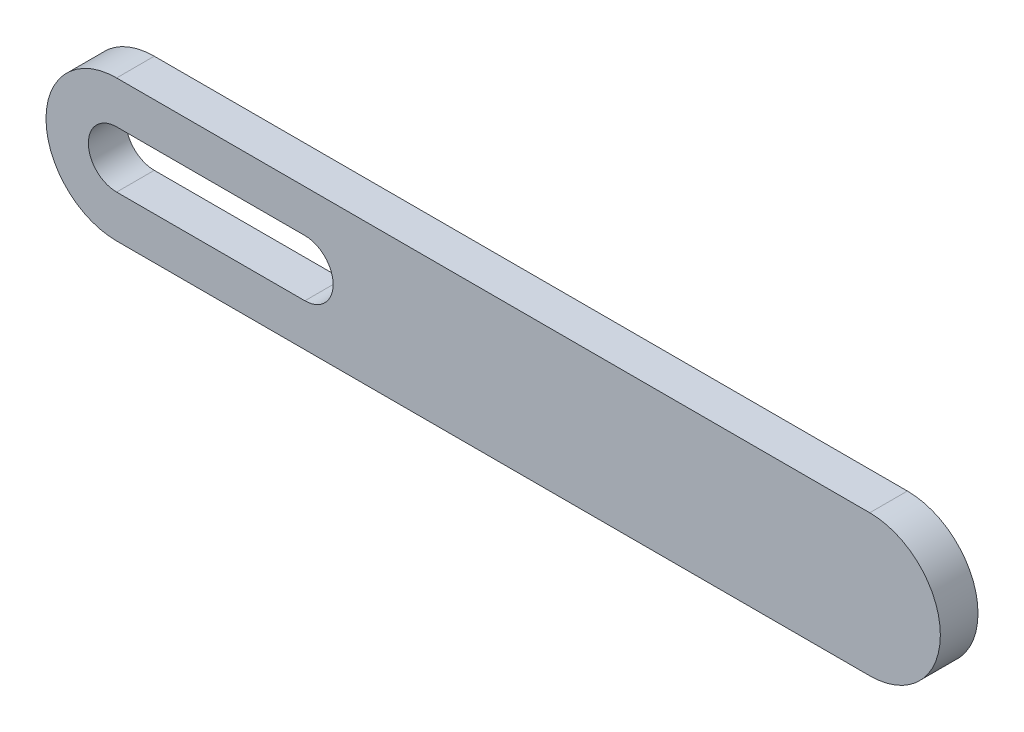
from build123d import *

# Parameters (mm, degrees)
BOSS_EXTRUDE1_DEPTH = 20


with BuildPart() as part:
    # Sketch1 → Boss-Extrude1 (new body)
    with BuildSketch(Plane.XY):
        with BuildLine():
            Line((-200, 37.5), (200, 37.5))
            ThreePointArc((200, 37.5), (237.5, 0), (200, -37.5))
            Line((200, -37.5), (-200, -37.5))
            ThreePointArc((-200, -37.5), (-237.5, 0), (-200, 37.5))
        make_face()
        with BuildLine():
            Line((-200, 15), (-100, 15))
            ThreePointArc((-100, 15), (-85, 0), (-100, -15))
            Line((-100, -15), (-200, -15))
            ThreePointArc((-200, -15), (-215, 0), (-200, 15))
        make_face(mode=Mode.SUBTRACT)
    extrude(amount=BOSS_EXTRUDE1_DEPTH)


solid = part.part
